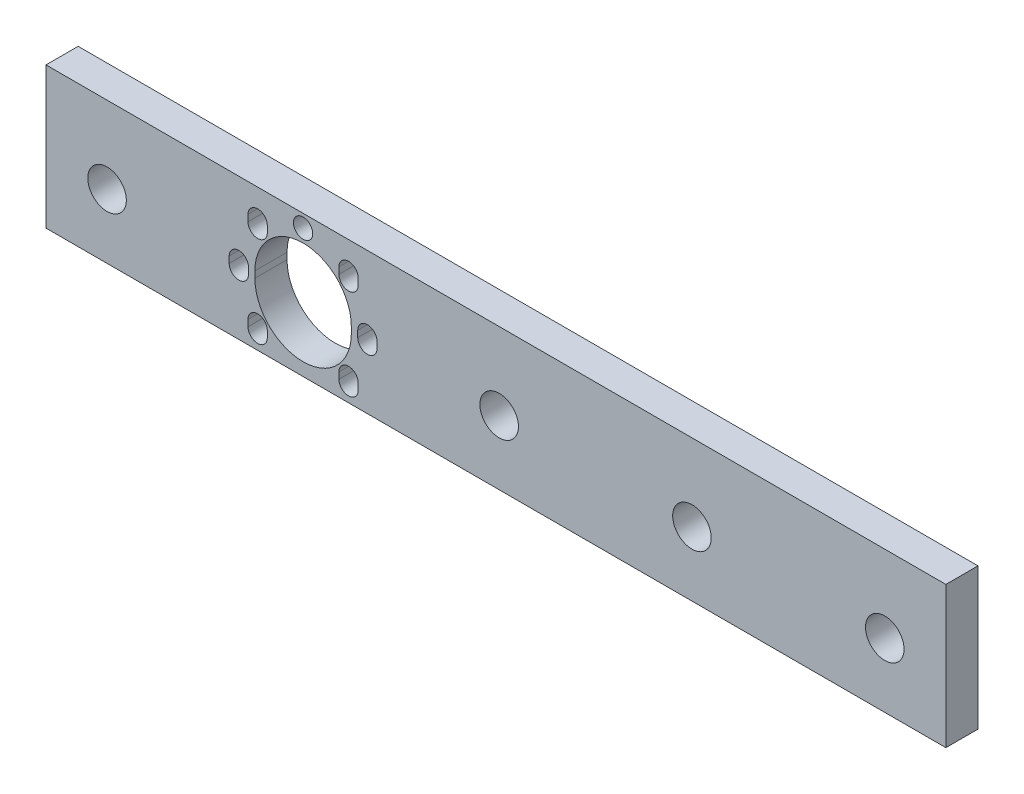
from build123d import *

# Parameters (mm, degrees)
SKETCH_1_R      = 1.5
SKETCH_1_R_2    = 3
EXTRUDE_1_DEPTH = 5


with BuildPart() as part:
    # 스케치1 → 보스-돌출1 (new body)
    with BuildSketch(Plane.XY):
        Polygon((0, 10.1), (0, 0.1), (140, 0.1), (140, 10.1), (140, 22.1), (0, 22.1), align=None)
        with Locations((40, 20.1)):
            Circle(SKETCH_1_R, mode=Mode.SUBTRACT)
        with Locations((70.5, 10.1)):
            Circle(SKETCH_1_R_2, mode=Mode.SUBTRACT)
        with Locations((100.5, 10.1)):
            Circle(SKETCH_1_R_2, mode=Mode.SUBTRACT)
        with Locations((130.5, 10.1)):
            Circle(SKETCH_1_R_2, mode=Mode.SUBTRACT)
        with Locations((9.5, 10.1)):
            Circle(SKETCH_1_R_2, mode=Mode.SUBTRACT)
        with BuildLine():
            Line((32.5, 10.1), (32.5, 10.6))
            ThreePointArc((32.5, 10.6), (40, 18.1), (47.5, 10.6))
            Line((47.5, 10.6), (47.5, 10.1))
            Line((47.5, 10.1), (47.5, 9.6))
            ThreePointArc((47.5, 9.6), (40, 2.1), (32.5, 9.6))
            Line((32.5, 9.6), (32.5, 10.1))
        make_face(mode=Mode.SUBTRACT)
        with BuildLine():
            Line((31.428932188, 3.028932188), (31.428932188, 3.528932188))
            ThreePointArc((31.428932188, 3.528932188), (32.928932188, 5.028932188), (34.428932188, 3.528932188))
            Line((34.428932188, 3.528932188), (34.428932188, 3.028932188))
            Line((34.428932188, 3.028932188), (34.428932188, 2.528932188))
            ThreePointArc((34.428932188, 2.528932188), (32.928932188, 1.028932188), (31.428932188, 2.528932188))
            Line((31.428932188, 2.528932188), (31.428932188, 3.028932188))
        make_face(mode=Mode.SUBTRACT)
        with BuildLine():
            Line((28.5, 10.1), (28.5, 10.6))
            ThreePointArc((28.5, 10.6), (30, 12.1), (31.5, 10.6))
            Line((31.5, 10.6), (31.5, 10.1))
            Line((31.5, 10.1), (31.5, 9.6))
            ThreePointArc((31.5, 9.6), (30, 8.1), (28.5, 9.6))
            Line((28.5, 9.6), (28.5, 10.1))
        make_face(mode=Mode.SUBTRACT)
        with BuildLine():
            Line((31.428932188, 17.171067812), (31.428932188, 17.671067812))
            ThreePointArc((31.428932188, 17.671067812), (32.928932188, 19.171067812), (34.428932188, 17.671067812))
            Line((34.428932188, 17.671067812), (34.428932188, 17.171067812))
            Line((34.428932188, 17.171067812), (34.428932188, 16.671067812))
            ThreePointArc((34.428932188, 16.671067812), (32.928932188, 15.171067812), (31.428932188, 16.671067812))
            Line((31.428932188, 16.671067812), (31.428932188, 17.171067812))
        make_face(mode=Mode.SUBTRACT)
        with BuildLine():
            Line((45.571067812, 17.171067812), (45.571067812, 16.671067812))
            ThreePointArc((45.571067812, 16.671067812), (47.071067812, 15.171067812), (48.571067812, 16.671067812))
            Line((48.571067812, 16.671067812), (48.571067812, 17.171067812))
            Line((48.571067812, 17.171067812), (48.571067812, 17.671067812))
            ThreePointArc((48.571067812, 17.671067812), (47.071067812, 19.171067812), (45.571067812, 17.671067812))
            Line((45.571067812, 17.671067812), (45.571067812, 17.171067812))
        make_face(mode=Mode.SUBTRACT)
        with BuildLine():
            Line((51.5, 10.1), (51.5, 9.6))
            ThreePointArc((51.5, 9.6), (50, 8.1), (48.5, 9.6))
            Line((48.5, 9.6), (48.5, 10.1))
            Line((48.5, 10.1), (48.5, 10.6))
            ThreePointArc((48.5, 10.6), (50, 12.1), (51.5, 10.6))
            Line((51.5, 10.6), (51.5, 10.1))
        make_face(mode=Mode.SUBTRACT)
        with BuildLine():
            Line((48.571067812, 3.028932188), (48.571067812, 3.528932188))
            ThreePointArc((48.571067812, 3.528932188), (47.071067812, 5.028932188), (45.571067812, 3.528932188))
            Line((45.571067812, 3.528932188), (45.571067812, 3.028932188))
            Line((45.571067812, 3.028932188), (45.571067812, 2.528932188))
            ThreePointArc((45.571067812, 2.528932188), (47.071067812, 1.028932188), (48.571067812, 2.528932188))
            Line((48.571067812, 2.528932188), (48.571067812, 3.028932188))
        make_face(mode=Mode.SUBTRACT)
    extrude(amount=EXTRUDE_1_DEPTH)


solid = part.part
